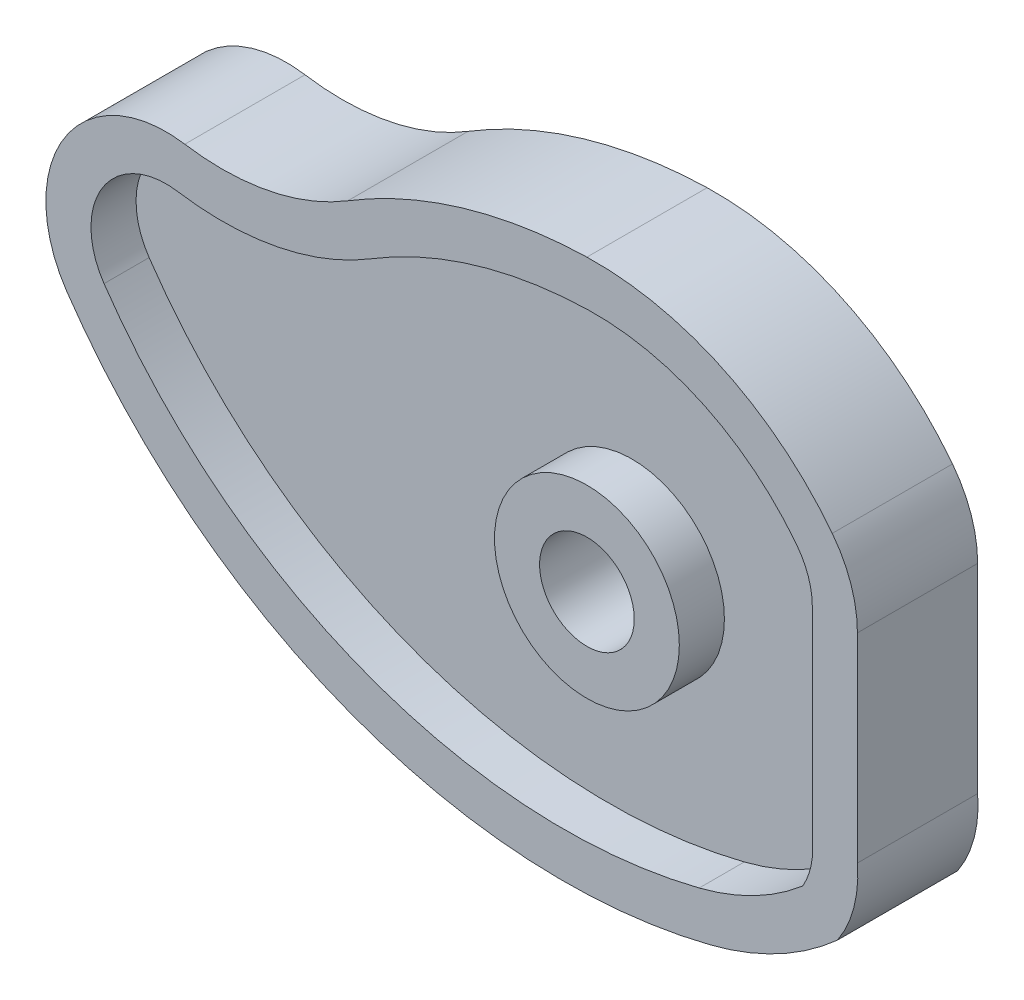
from build123d import *

# Parameters (mm, degrees)
SKETCH1_R           = 20
BOSS_EXTRUDE1_DEPTH = 50.8
SKETCH2_R           = 39.05
CUT_EXTRUDE2_DEPTH  = 19.05


with BuildPart() as part:
    # Sketch1 → Boss-Extrude1 (new body)
    with BuildSketch(Plane.XY):
        with BuildLine():
            Line((114.3, 42.12), (114.3, -42.12))
            ThreePointArc((114.3, -42.12), (112.822576646, -59.071852399), (105.83, -74.584813154))
            ThreePointArc((105.83, -74.584813154), (80.699418732, -92.137099347), (52.095309818, -103.156800734))
            ThreePointArc((52.095309818, -103.156800734), (-100.055730281, -94.328415864), (-219.763830855, 0))
            ThreePointArc((-219.763830855, 0), (-220.731129195, 55.788021762), (-169.90706285, 78.813080248))
            ThreePointArc((-169.90706285, 78.813080248), (-134.239730538, 79.543465906), (-101.023628706, 92.558174376))
            ThreePointArc((-101.023628706, 92.558174376), (-52.482772845, 114.165280445), (0, 122.450223109))
            ThreePointArc((0, 122.450223109), (57.719827825, 110.208823216), (103.678545425, 73.205760206))
            ThreePointArc((103.678545425, 73.205760206), (111.571353775, 58.545131543), (114.3, 42.12))
        make_face()
        Circle(SKETCH1_R, mode=Mode.SUBTRACT)
    extrude(amount=BOSS_EXTRUDE1_DEPTH)

    # Sketch2 → Cut-Extrude2 (cut)
    with BuildSketch(Plane.XY.offset(50.8)):
        with BuildLine():
            ThreePointArc((95.25, 42.12), (93.54459611, 52.385707215), (88.61159089, 61.548600129))
            ThreePointArc((88.61159089, 61.548600129), (49.546680931, 93.001203687), (0.484827279, 103.406393597))
            ThreePointArc((0.484827279, 103.406393597), (-47.077685611, 95.898164307), (-91.067836236, 76.316724432))
            ThreePointArc((-91.067836236, 76.316724432), (-130.511957161, 60.861758124), (-172.866914281, 59.994425155))
            ThreePointArc((-172.866914281, 59.994425155), (-204.631955747, 45.603763601), (-204.027394284, 10.73625))
            ThreePointArc((-204.027394284, 10.73625), (-93.297401253, -76.517534674), (47.442310838, -84.683790679))
            ThreePointArc((47.442310838, -84.683790679), (70.618294037, -75.913232441), (91.183680686, -62.088842363))
            ThreePointArc((91.183680686, -62.088842363), (94.722194745, -52.857883684), (95.25, -42.986049939))
            Line((95.25, -42.986049939), (95.25, 42.12))
        make_face()
        Circle(SKETCH2_R, mode=Mode.SUBTRACT)
    cut_extrude2 = extrude(amount=-CUT_EXTRUDE2_DEPTH, mode=Mode.SUBTRACT)

    # Mirror5: Cut-Extrude2 across plane
    add(cut_extrude2.mirror(Plane.XY.offset(25.4)), mode=Mode.SUBTRACT)


solid = part.part
